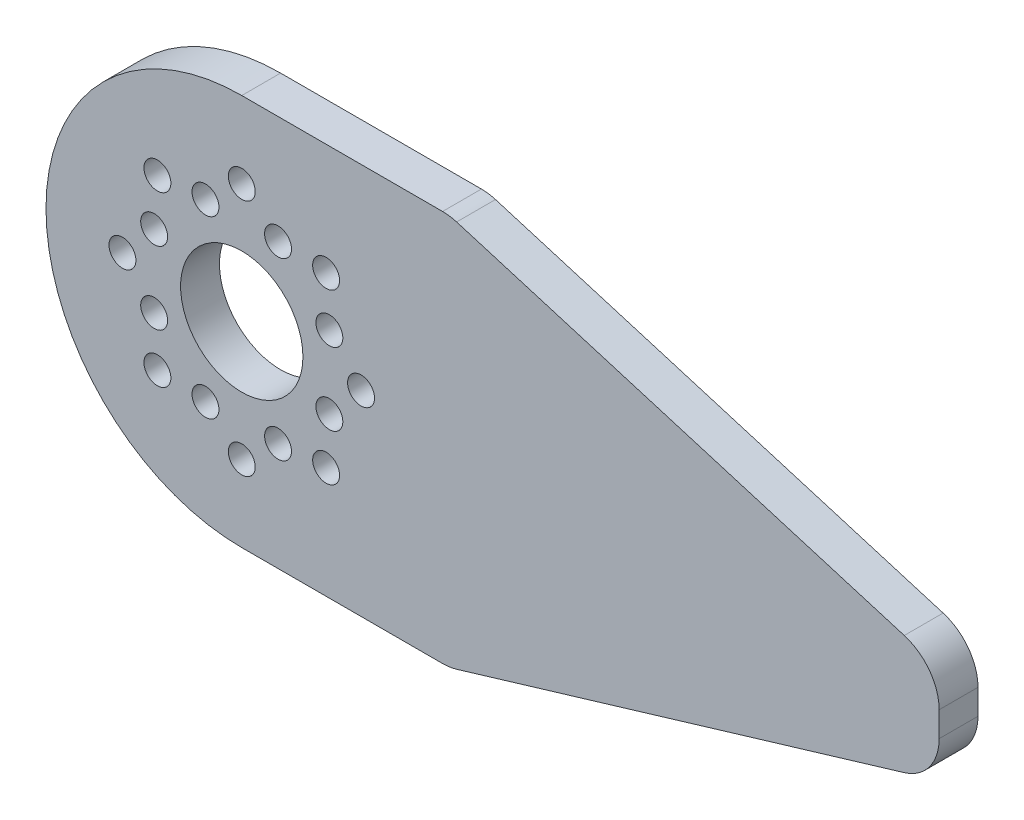
from build123d import *

# Parameters (mm, degrees)
SKETCH1_R           = 1.1
SKETCH1_R_2         = 5
BOSS_EXTRUDE1_DEPTH = 3.175
CUT_EXTRUDE1_DEPTH  = 3.175
FILLET1_R           = 4


with BuildPart() as part:
    # Sketch1 → Boss-Extrude1 (new body)
    with BuildSketch(Plane.XY):
        with BuildLine():
            Line((19, 0), (76, 0))
            Line((76, 0), (76, 32))
            Line((76, 32), (19, 32))
            ThreePointArc((19, 32), (3, 16), (19, 0))
        make_face()
        with Locations((25.894291117, 22.894291117)):
            Circle(SKETCH1_R, mode=Mode.SUBTRACT)
        with Locations((19, 25.75)):
            Circle(SKETCH1_R, mode=Mode.SUBTRACT)
        with Locations((28.75, 16)):
            Circle(SKETCH1_R, mode=Mode.SUBTRACT)
        with Locations((25.894291117, 9.105708883)):
            Circle(SKETCH1_R, mode=Mode.SUBTRACT)
        with Locations((19, 6.25)):
            Circle(SKETCH1_R, mode=Mode.SUBTRACT)
        with Locations((12.105708883, 9.105708883)):
            Circle(SKETCH1_R, mode=Mode.SUBTRACT)
        with Locations((9.25, 16)):
            Circle(SKETCH1_R, mode=Mode.SUBTRACT)
        with Locations((12.105708883, 22.894291117)):
            Circle(SKETCH1_R, mode=Mode.SUBTRACT)
        with Locations((19, 16)):
            Circle(SKETCH1_R_2, mode=Mode.SUBTRACT)
        with Locations((26.160066377, 18.965796601)):
            Circle(SKETCH1_R, mode=Mode.SUBTRACT)
        with Locations((21.965796601, 23.160066377)):
            Circle(SKETCH1_R, mode=Mode.SUBTRACT)
        with Locations((26.160066377, 13.034203399)):
            Circle(SKETCH1_R, mode=Mode.SUBTRACT)
        with Locations((21.965796601, 8.839933623)):
            Circle(SKETCH1_R, mode=Mode.SUBTRACT)
        with Locations((16.034203399, 8.839933623)):
            Circle(SKETCH1_R, mode=Mode.SUBTRACT)
        with Locations((11.839933623, 13.034203399)):
            Circle(SKETCH1_R, mode=Mode.SUBTRACT)
        with Locations((11.839933623, 18.965796601)):
            Circle(SKETCH1_R, mode=Mode.SUBTRACT)
        with Locations((16.034203399, 23.160066377)):
            Circle(SKETCH1_R, mode=Mode.SUBTRACT)
    extrude(amount=BOSS_EXTRUDE1_DEPTH)

    # Sketch2 → Cut-Extrude1 (cut)
    with BuildSketch(Plane.XY.offset(3.175)):
        Polygon((76, 32), (76, 20), (36, 32), align=None)
        Polygon((76, 0), (76, 12), (36, 0), align=None)
    extrude(amount=-CUT_EXTRUDE1_DEPTH, mode=Mode.SUBTRACT)

    # Fillet1
    fillet1_edges = [part.edges().sort_by_distance(p)[0] for p in [
        (36, 0, 1.5875),
        (76, 12, 1.5875),
        (36, 32, 1.5875),
        (76, 20, 1.5875),
    ]]
    fillet(fillet1_edges, radius=FILLET1_R)


solid = part.part
